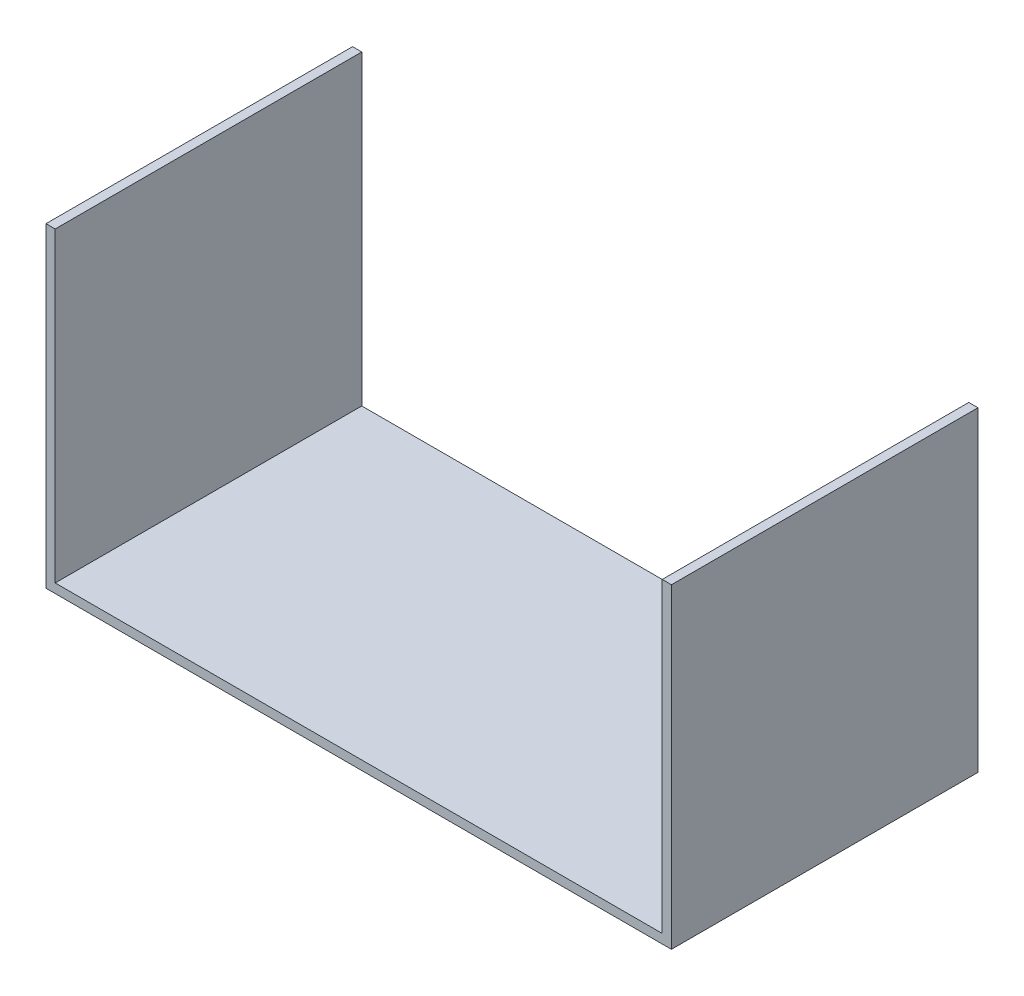
from build123d import *

# Parameters (mm, degrees)
SKETCH1_W           = 102
SKETCH1_H           = 50
BOSS_EXTRUDE1_DEPTH = 1.5
SKETCH2_W           = 1.5
SKETCH2_H           = 50
BOSS_EXTRUDE2_DEPTH = 50


with BuildPart() as part:
    # Sketch1 → Boss-Extrude1 (new body)
    with BuildSketch(Plane(origin=(0, 0, 0), x_dir=(1, 0, 0), z_dir=(0, 1, 0))):
        with Locations((51, 25)):
            Rectangle(SKETCH1_W, SKETCH1_H)
    extrude(amount=BOSS_EXTRUDE1_DEPTH)

    # Sketch2 → Boss-Extrude2 (add)
    with BuildSketch(Plane(origin=(0, 1.5, 0), x_dir=(1, 0, 0), z_dir=(0, 1, 0))):
        with Locations((0.75, 25)):
            Rectangle(SKETCH2_W, SKETCH2_H)
        with Locations((101.25, 25)):
            Rectangle(SKETCH2_W, SKETCH2_H)
    extrude(amount=BOSS_EXTRUDE2_DEPTH)


solid = part.part
